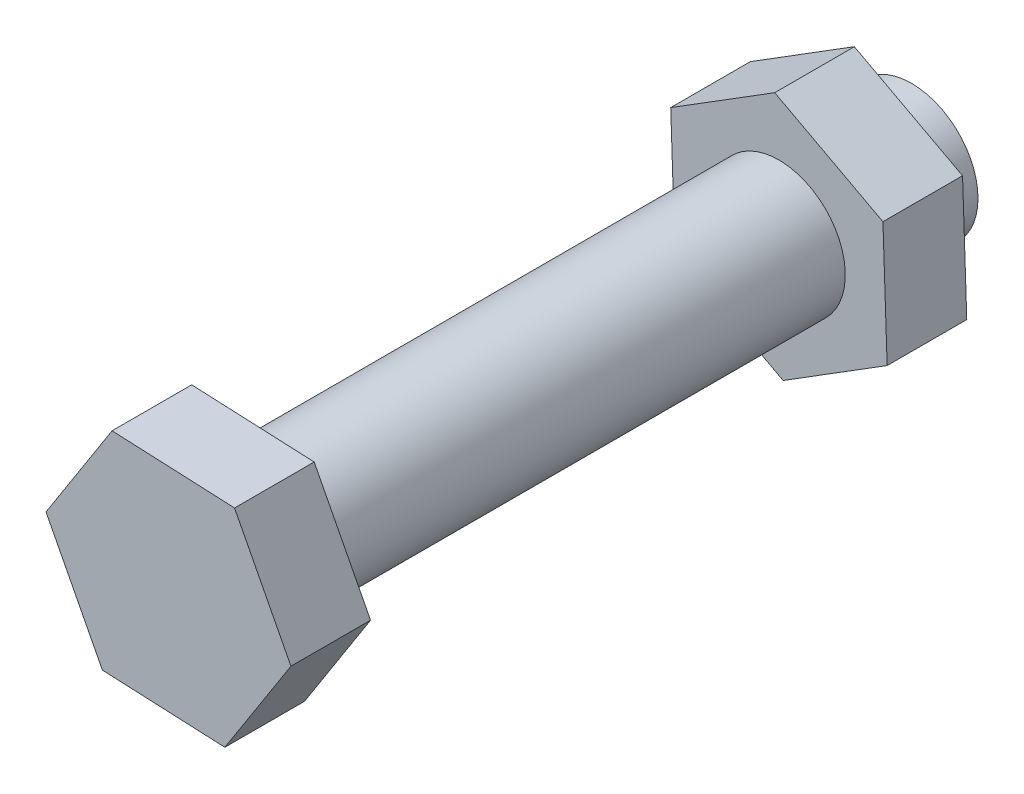
from build123d import *

# Parameters (mm, degrees)
SKETCH1_R           = 2.5
BOSS_EXTRUDE1_DEPTH = 23
BOSS_EXTRUDE2_DEPTH = 3
BOSS_EXTRUDE3_DEPTH = 3
BOSS_EXTRUDE4_START = 2
SKETCH4_R           = 2.5
BOSS_EXTRUDE4_DEPTH = 2


with BuildPart() as part:
    # Sketch1 → Boss-Extrude1 (new body)
    with BuildSketch(Plane.XY):
        Circle(SKETCH1_R)
    extrude(amount=BOSS_EXTRUDE1_DEPTH)

    # Sketch2 → Boss-Extrude2 (add)
    with BuildSketch(Plane.XY.offset(23)):
        Polygon((2.489504252, 3.890462943), (-2.124487616, 4.101205397), (-4.613991867, 0.210742453), (-2.489504252, -3.890462943), (2.124487616, -4.101205397), (4.613991867, -0.210742453), align=None)
    extrude(amount=BOSS_EXTRUDE2_DEPTH)

    # Sketch3 → Boss-Extrude3 (add)
    with BuildSketch(Plane(origin=(0, 0, 0), x_dir=(-1, 0, 0), z_dir=(0, 0, -1))):
        Polygon((4.077074227, 2.170437533), (0.158883072, 4.61606862), (-3.918191154, 2.445631087), (-4.077074227, -2.170437533), (-0.158883072, -4.61606862), (3.918191154, -2.445631087), align=None)
    extrude(amount=-BOSS_EXTRUDE3_DEPTH)

    # Sketch4 → Boss-Extrude4 (add)
    with BuildSketch(Plane(origin=(0, 0, 0), x_dir=(-1, 0, 0), z_dir=(0, 0, -1)).offset(BOSS_EXTRUDE4_START)):
        Circle(SKETCH4_R)
    extrude(amount=-BOSS_EXTRUDE4_DEPTH)


solid = part.part
